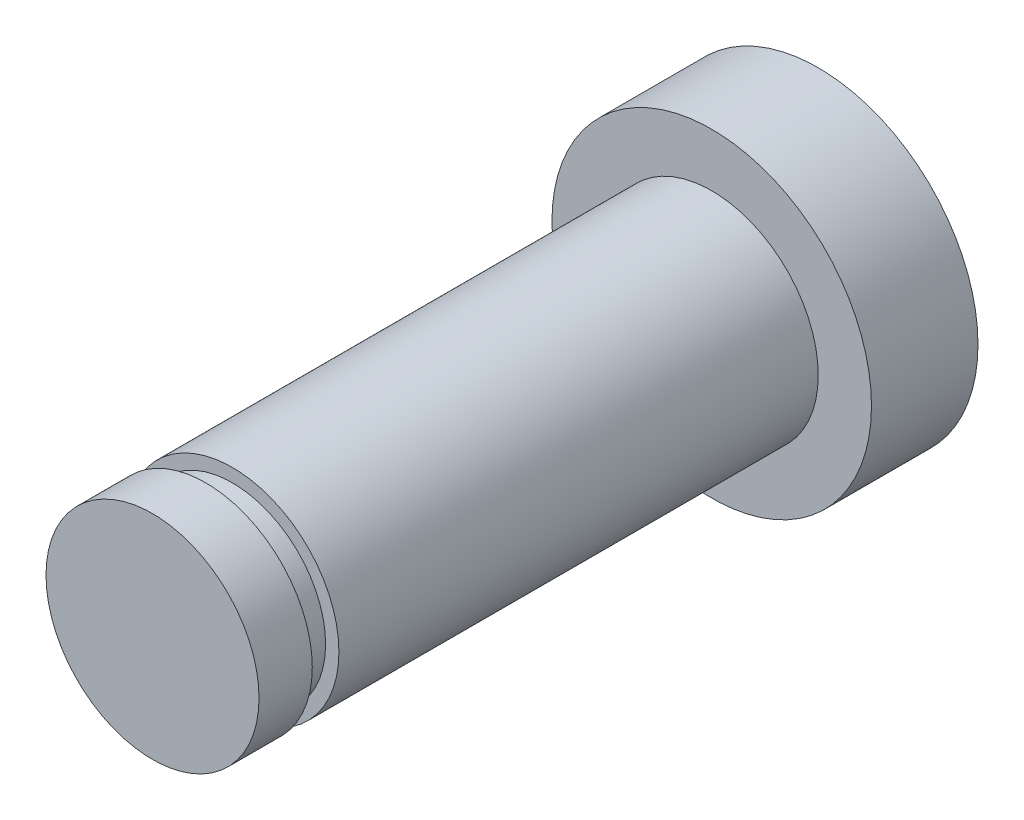
from build123d import *

# Parameters (mm, degrees)
SKETCH_1_R      = 6
EXTRUDE_1_DEPTH = 4
SKETCH_2_R      = 4
EXTRUDE_2_DEPTH = 18
SKETCH_3_R      = 3.5
EXTRUDE_3_DEPTH = 1
SKETCH_4_R      = 4
EXTRUDE_4_DEPTH = 2


with BuildPart() as part:
    # 草图1 → 凸台-拉伸1 (new body)
    with BuildSketch(Plane.XY):
        Circle(SKETCH_1_R)
    extrude(amount=EXTRUDE_1_DEPTH)

    # 草图2 → 凸台-拉伸2 (add)
    with BuildSketch(Plane.XY.offset(4)):
        Circle(SKETCH_2_R)
    extrude(amount=EXTRUDE_2_DEPTH)

    # 草图3 → 凸台-拉伸3 (add)
    with BuildSketch(Plane.XY.offset(22)):
        Circle(SKETCH_3_R)
    extrude(amount=EXTRUDE_3_DEPTH)

    # 草图4 → 凸台-拉伸4 (add)
    with BuildSketch(Plane.XY.offset(23)):
        Circle(SKETCH_4_R)
    extrude(amount=EXTRUDE_4_DEPTH)


solid = part.part
